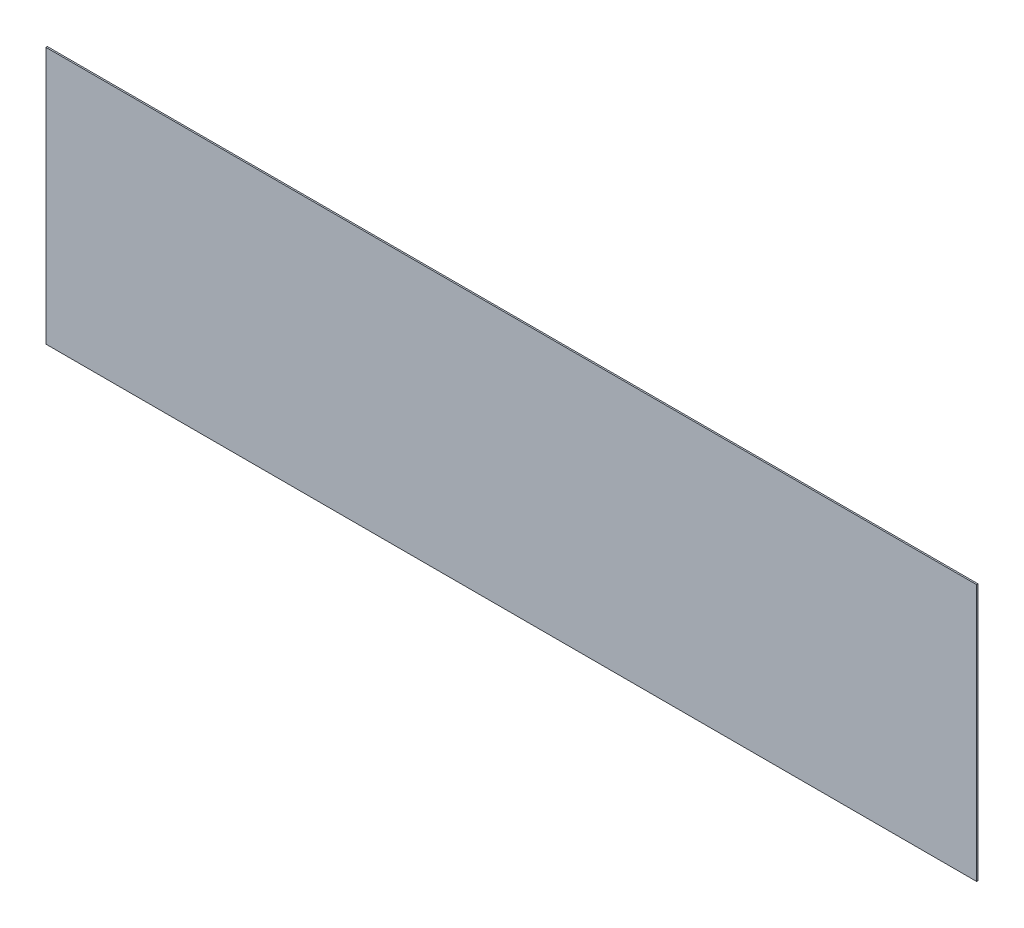
from build123d import *

# Parameters (mm, degrees)
DET_ARKA_IC_SAC_1_START = -757.5
SKETCH1_W               = 648
SKETCH1_H               = 179
DET_ARKA_IC_SAC_1_DEPTH = 1


with BuildPart() as part:
    # Sketch1 → DET_arka_ic_sac_1 (new body)
    with BuildSketch(Plane.XY.offset(DET_ARKA_IC_SAC_1_START)):
        with Locations((1026, 1558.5)):
            Rectangle(SKETCH1_W, SKETCH1_H)
    extrude(amount=-DET_ARKA_IC_SAC_1_DEPTH)


solid = part.part
